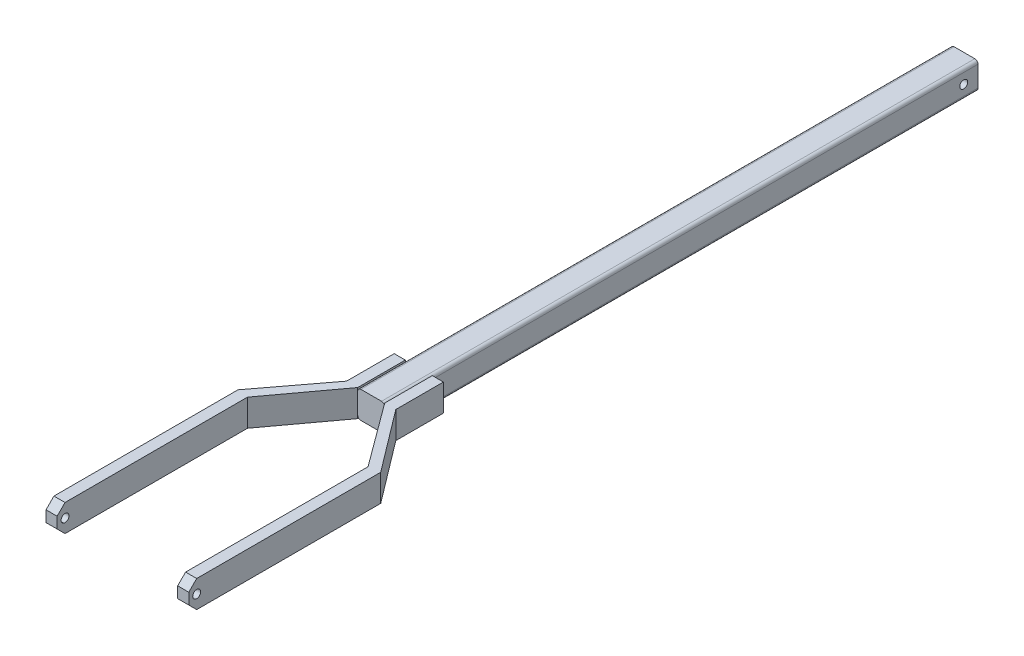
from build123d import *

# Parameters (mm, degrees)
EXTRUDE1_DEPTH = 374
EXTRUDE2_DEPTH = 17
SKETCH4_R      = 2.5
EXTRUDE3_DEPTH = 543.19933305


with BuildPart() as part:
    # Sketch1 → Extrude1 (new body)
    with BuildSketch(Plane.XY):
        with BuildLine():
            Line((-38.142101627, 26.909417684), (-25.142101627, 26.909417684))
            ThreePointArc((-25.142101627, 26.909417684), (-23.727888065, 26.323631246), (-23.142101627, 24.909417684))
            Line((-23.142101627, 24.909417684), (-23.142101627, 11.909417684))
            ThreePointArc((-23.142101627, 11.909417684), (-23.727888065, 10.495204122), (-25.142101627, 9.909417684))
            Line((-25.142101627, 9.909417684), (-38.142101627, 9.909417684))
            ThreePointArc((-38.142101627, 9.909417684), (-39.55631519, 10.495204122), (-40.142101627, 11.909417684))
            Line((-40.142101627, 11.909417684), (-40.142101627, 24.909417684))
            ThreePointArc((-40.142101627, 24.909417684), (-39.55631519, 26.323631246), (-38.142101627, 26.909417684))
        make_face()
    extrude(amount=EXTRUDE1_DEPTH)

    # Sketch2 → Extrude2 (add)
    with BuildSketch(Plane(origin=(0, 26.909417684, 0), x_dir=(1, 0, 0), z_dir=(0, 1, 0))):
        Polygon((-23.142101627, -374), (-23.142101627, -344), (-16.142101627, -344), (-16.142101627, -374), (13.357898373, -413), (13.357898373, -534), (6.357898373, -534), (6.357898373, -414), align=None)
        Polygon((-40.142101627, -374), (-40.142101627, -344), (-47.142101627, -344), (-47.142101627, -374), (-76.642101627, -413), (-76.642101627, -534), (-69.642101627, -534), (-69.642101627, -414), align=None)
    extrude(amount=-EXTRUDE2_DEPTH)

    # Sketch4 → Extrude3 (cut, through all)
    with BuildSketch(Plane(origin=(13.357898373, 0, 0), x_dir=(0, 0, -1), z_dir=(1, 0, 0))):
        with Locations((-529, 18.409417684)):
            Circle(SKETCH4_R)
        with Locations((-9, 18.409417684)):
            Circle(SKETCH4_R)
        Polygon((-529, 26.909417684), (-534, 21.909417684), (-534, 14.909417684), (-529, 9.909417684), (-529, 0), (-556.33894416, 6.720406123), (-552.141138814, 40.050556498), (-531.5, 37.450883772), align=None)
    extrude(amount=-EXTRUDE3_DEPTH, mode=Mode.SUBTRACT)


solid = part.part
